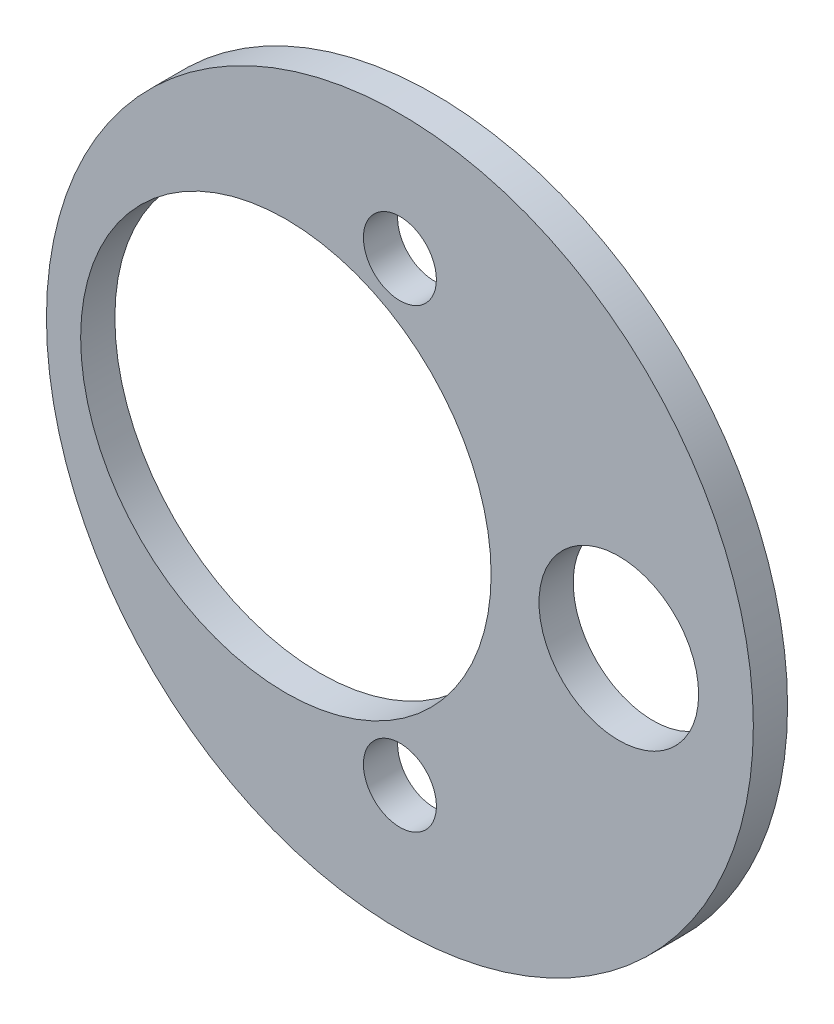
from build123d import *

# Parameters (mm, degrees)
SKETCH_1_R      = 15.5
SKETCH_1_R_2    = 9
SKETCH_1_R_3    = 3.5
SKETCH_1_R_4    = 1.6
EXTRUDE_1_DEPTH = 1.5


with BuildPart() as part:
    # Эскиз1 → Бобышка-Вытянуть1 (new body)
    with BuildSketch(Plane.XY):
        Circle(SKETCH_1_R)
        with Locations((-5, 0)):
            Circle(SKETCH_1_R_2, mode=Mode.SUBTRACT)
        with Locations((9.6, 0)):
            Circle(SKETCH_1_R_3, mode=Mode.SUBTRACT)
        with Locations((0, 10)):
            Circle(SKETCH_1_R_4, mode=Mode.SUBTRACT)
        with Locations(Location((0, -10, 0), (0, 0, 180))):
            Circle(SKETCH_1_R_4, mode=Mode.SUBTRACT)
    extrude(amount=EXTRUDE_1_DEPTH)


solid = part.part
